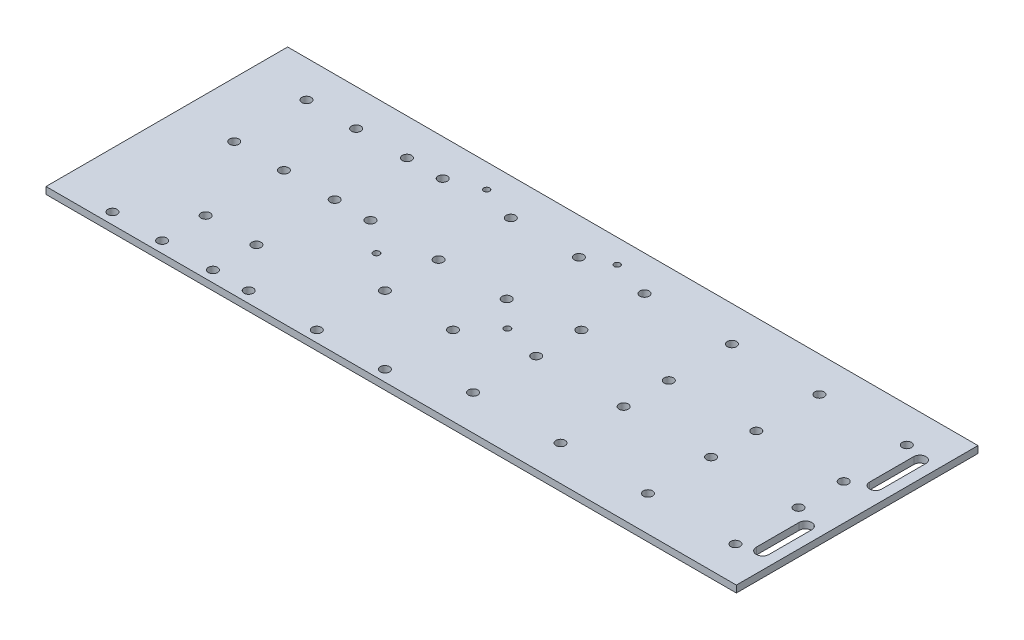
from build123d import *

# Parameters (mm, degrees)
SKETCH1_W           = 105
SKETCH1_H           = 3
BOSS_EXTRUDE1_DEPTH = 300
SKETCH2_R           = 2
SKETCH2_R_2         = 1.374892706
SKETCH2_R_3         = 1.354217853
SKETCH2_R_4         = 1.307593734
SKETCH2_R_5         = 1.273931832
CUT_EXTRUDE1_DEPTH  = 10


with BuildPart() as part:
    # Sketch1 → Boss-Extrude1 (new body)
    with BuildSketch(Plane(origin=(0, 0, 0), x_dir=(0, 0, -1), z_dir=(1, 0, 0))):
        Rectangle(SKETCH1_W, SKETCH1_H)
    extrude(amount=-BOSS_EXTRUDE1_DEPTH)

    # Sketch2 → Cut-Extrude1 (cut)
    with BuildSketch(Plane.XZ.offset(1.5)):
        with Locations(Location((-187.17418267, 18.052570887, 0), (0, 0, 270))):
            Circle(SKETCH2_R)
        with Locations(Location((-157.57418267, 18.052570887, 0), (0, 0, 270))):
            Circle(SKETCH2_R)
        with Locations(Location((-157.57418267, 47.652570887, 0), (0, 0, 270))):
            Circle(SKETCH2_R)
        with Locations(Location((-187.17418267, 47.652570887, 0), (0, 0, 270))):
            Circle(SKETCH2_R)
        with Locations(Location((-203.080283558, 5.823951961, 0), (0, 0, 270))):
            Circle(SKETCH2_R_2)
        with Locations(Location((-146.289268611, 5.713822454, 0), (0, 0, 270))):
            Circle(SKETCH2_R_3)
        with Locations(Location((-146.435482331, -42.141729042, 0), (0, 0, 270))):
            Circle(SKETCH2_R_4)
        with Locations(Location((-203.080283558, -42.071168524, 0), (0, 0, 270))):
            Circle(SKETCH2_R_5)
        with Locations(Location((-157.57418267, -36.654156393, 0), (0, 0, 270))):
            Circle(SKETCH2_R)
        with Locations(Location((-187.17418267, -36.654156393, 0), (0, 0, 270))):
            Circle(SKETCH2_R)
        with Locations(Location((-216.77418267, -36.654156393, 0), (0, 0, 270))):
            Circle(SKETCH2_R)
        with Locations(Location((-91.671041898, 37.247626886, 0), (0, 0, 270))):
            Circle(SKETCH2_R)
        with Locations(Location((-216.77418267, 47.652570887, 0), (0, 0, 270))):
            Circle(SKETCH2_R)
        with Locations(Location((-254.388823597, 47.652570887, 0), (0, 0, 270))):
            Circle(SKETCH2_R)
        with Locations(Location((-275.97418267, 47.652570887, 0), (0, 0, 270))):
            Circle(SKETCH2_R)
        with Locations(Location((-157.57418267, -5.272741789, 0), (0, 0, 270))):
            Circle(SKETCH2_R)
        with Locations(Location((-187.17418267, -5.272741789, 0), (0, 0, 270))):
            Circle(SKETCH2_R)
        with Locations(Location((-216.77418267, -5.272741789, 0), (0, 0, 270))):
            Circle(SKETCH2_R)
        with Locations(Location((-232.313628015, 47.652570887, 0), (0, 0, 270))):
            Circle(SKETCH2_R)
        with Locations(Location((-275.97418267, -5.272741789, 0), (0, 0, 270))):
            Circle(SKETCH2_R)
        with Locations(Location((-275.97418267, -36.654156393, 0), (0, 0, 270))):
            Circle(SKETCH2_R)
        with Locations(Location((-232.313628015, -5.272741789, 0), (0, 0, 270))):
            Circle(SKETCH2_R)
        with Locations(Location((-232.313628015, 28.747940449, 0), (0, 0, 270))):
            Circle(SKETCH2_R)
        with Locations(Location((-254.388823597, 28.747940449, 0), (0, 0, 270))):
            Circle(SKETCH2_R)
        with Locations(Location((-254.388823597, -5.272741789, 0), (0, 0, 270))):
            Circle(SKETCH2_R)
        with Locations(Location((-254.388823597, -36.654156393, 0), (0, 0, 270))):
            Circle(SKETCH2_R)
        with Locations(Location((-232.313628015, -36.654156393, 0), (0, 0, 270))):
            Circle(SKETCH2_R)
        with Locations(Location((-53.671041898, 37.247626886, 0), (0, 0, 270))):
            Circle(SKETCH2_R)
        with Locations(Location((-15.671041898, 37.247626886, 0), (0, 0, 270))):
            Circle(SKETCH2_R)
        with Locations(Location((-129.671041898, 37.247626886, 0), (0, 0, 270))):
            Circle(SKETCH2_R)
        with Locations(Location((-129.671041898, 9.821730669, 0), (0, 0, 270))):
            Circle(SKETCH2_R)
        with Locations(Location((-91.671041898, 9.821730669, 0), (0, 0, 270))):
            Circle(SKETCH2_R)
        with Locations(Location((-53.671041898, 9.821730669, 0), (0, 0, 270))):
            Circle(SKETCH2_R)
        with Locations(Location((-15.671041898, 9.821730669, 0), (0, 0, 270))):
            Circle(SKETCH2_R)
        with Locations(Location((-129.671041898, -37.247626886, 0), (0, 0, 90))):
            Circle(SKETCH2_R)
        with Locations(Location((-129.671041898, -9.821730669, 0), (0, 0, 90))):
            Circle(SKETCH2_R)
        with Locations(Location((-91.671041898, -9.821730669, 0), (0, 0, 90))):
            Circle(SKETCH2_R)
        with Locations(Location((-53.671041898, -9.821730669, 0), (0, 0, 90))):
            Circle(SKETCH2_R)
        with Locations(Location((-15.671041898, -9.821730669, 0), (0, 0, 90))):
            Circle(SKETCH2_R)
        with Locations(Location((-91.671041898, -37.247626886, 0), (0, 0, 90))):
            Circle(SKETCH2_R)
        with Locations(Location((-53.671041898, -37.247626886, 0), (0, 0, 90))):
            Circle(SKETCH2_R)
        with Locations(Location((-15.671041898, -37.247626886, 0), (0, 0, 90))):
            Circle(SKETCH2_R)
        with BuildLine():
            Line((-9.819471051, -34.403955007), (-9.819471051, -15.203651424))
            ThreePointArc((-9.819471051, -15.203651424), (-7.18680013, -12.570980503), (-4.554129209, -15.203651424))
            Line((-4.554129209, -15.203651424), (-4.554129209, -34.403955007))
            ThreePointArc((-4.554129209, -34.403955007), (-7.18680013, -37.036625928), (-9.819471051, -34.403955007))
        make_face()
        with BuildLine():
            Line((-4.430775444, 33.91650296), (-4.430775444, 15.317539102))
            ThreePointArc((-4.430775444, 15.317539102), (-7.18680013, 12.561514417), (-9.942824816, 15.317539102))
            Line((-9.942824816, 15.317539102), (-9.942824816, 33.91650296))
            ThreePointArc((-9.942824816, 33.91650296), (-7.18680013, 36.672527645), (-4.430775444, 33.91650296))
        make_face()
    extrude(amount=-CUT_EXTRUDE1_DEPTH, mode=Mode.SUBTRACT)


solid = part.part
